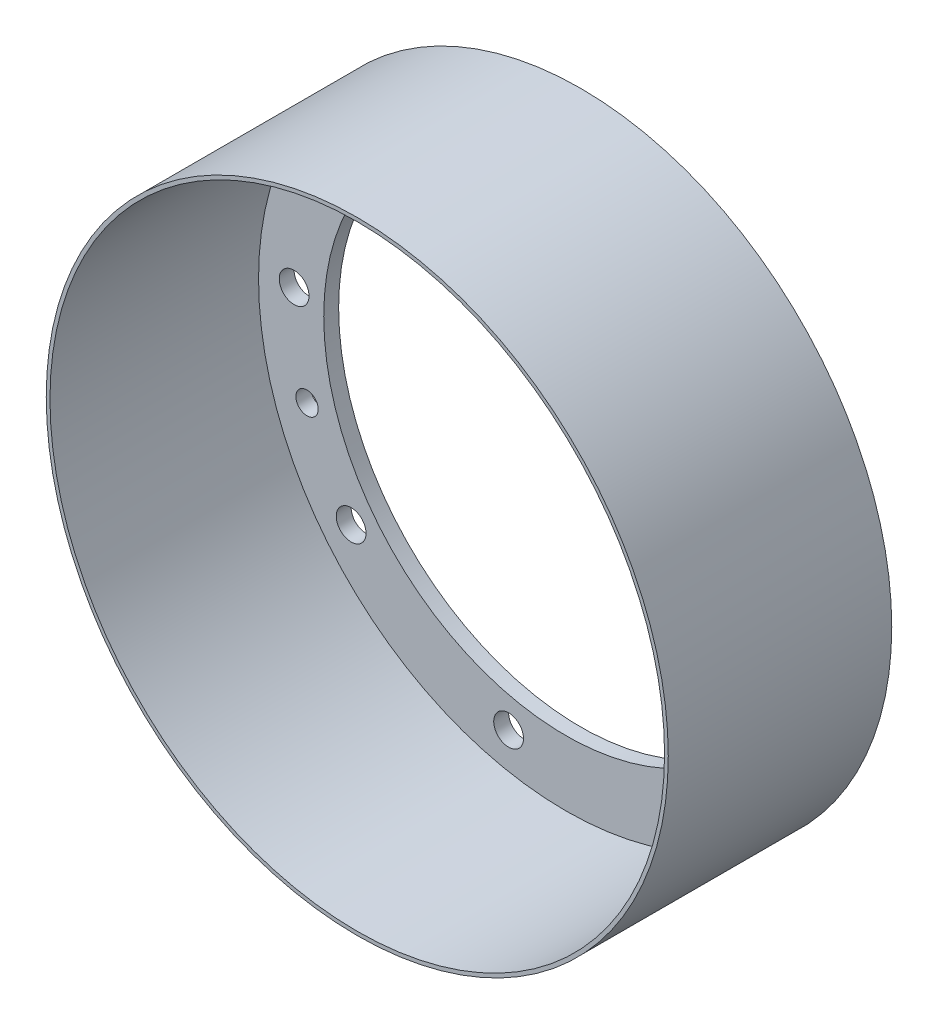
from build123d import *

# Parameters (mm, degrees)
SKETCH2_R           = 41.75
SKETCH2_R_2         = 41.25
BOSS_EXTRUDE1_DEPTH = 28
BOSS_EXTRUDE2_START = -2
SKETCH2_3_R         = 41.75
SKETCH2_3_R_2       = 2
SKETCH2_3_R_3       = 1.5
SKETCH2_3_R_4       = 32.5
BOSS_EXTRUDE2_DEPTH = 2


with BuildPart() as part:
    # Sketch2 → Boss-Extrude1 (new body)
    with BuildSketch(Plane.XY):
        with Locations(Location((-114.563267105, -12.719508093, 0), (0, 0, 180))):
            Circle(SKETCH2_R)
        with Locations(Location((-114.563267105, -12.719508093, 0), (0, 0, 180))):
            Circle(SKETCH2_R_2, mode=Mode.SUBTRACT)
    extrude(amount=BOSS_EXTRUDE1_DEPTH)

    # Sketch2<3> → Boss-Extrude2 (add)
    with BuildSketch(Plane.XY.offset(BOSS_EXTRUDE2_START)):
        with Locations(Location((-114.563267105, -12.719508093, 0), (0, 0, 180))):
            Circle(SKETCH2_3_R)
        with Locations((-143.38415281, -35.116082543)):
            Circle(SKETCH2_3_R_2, mode=Mode.SUBTRACT)
        with Locations((-122.245105889, -48.401987728)):
            Circle(SKETCH2_3_R_2, mode=Mode.SUBTRACT)
        with Locations((-149.30612033, -23.908080375)):
            Circle(SKETCH2_3_R_3, mode=Mode.SUBTRACT)
        with Locations((-97.511641226, -44.991664124)):
            Circle(SKETCH2_3_R_2, mode=Mode.SUBTRACT)
        with Locations((-87.502252663, -37.213415445)):
            Circle(SKETCH2_3_R_3, mode=Mode.SUBTRACT)
        with Locations((-80.756821819, -26.480840048)):
            Circle(SKETCH2_3_R_2, mode=Mode.SUBTRACT)
        with Locations((-151.037587002, -11.350571264)):
            Circle(SKETCH2_3_R_2, mode=Mode.SUBTRACT)
        with Locations((-141.624281546, 11.77439926)):
            Circle(SKETCH2_3_R_2, mode=Mode.SUBTRACT)
        with Locations((-119.548826684, 23.438398314)):
            Circle(SKETCH2_3_R_2, mode=Mode.SUBTRACT)
        with Locations((-114.563267105, -12.719508093)):
            Circle(SKETCH2_3_R_4, mode=Mode.SUBTRACT)
        with Locations((-79.820413879, -1.53093581)):
            Circle(SKETCH2_3_R_2, mode=Mode.SUBTRACT)
        with Locations((-95.140573086, 18.183711109)):
            Circle(SKETCH2_3_R_2, mode=Mode.SUBTRACT)
        with Locations((-106.88142832, 22.962971542)):
            Circle(SKETCH2_3_R_3, mode=Mode.SUBTRACT)
    extrude(amount=BOSS_EXTRUDE2_DEPTH)


solid = part.part
